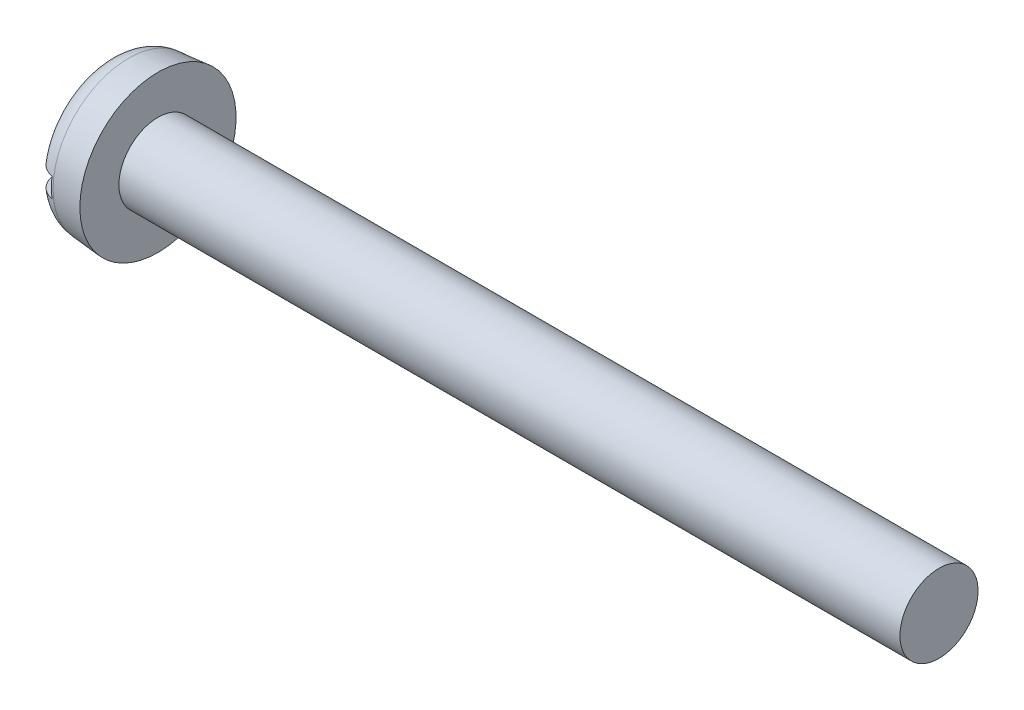
from build123d import *

# Parameters (mm, degrees)
FILLET2_R  = 0.6
SKETCH2_W  = 4
SKETCH2_H  = 0.5
SLOT_DEPTH = 0.5


with BuildPart() as part:
    # BodySke → Base-Revolve (revolve)
    with BuildSketch(Plane.XY, mode=Mode.PRIVATE) as base_revolve_sk:
        Polygon((1.3, 1), (1.3, 2), (0, 1.886264737), (0, 0), (21.3, 0), (21.3, 1), align=None)
    revolve(base_revolve_sk.sketch.rotate(Axis((-25.4, 0, 0), (1, 0, 0)), 90), axis=Axis((-25.4, 0, 0), (1, 0, 0)))

    # Fillet2
    fillet2_edges = [part.edges().sort_by_distance(p)[0] for p in [
        (0, 0, -1.886264737),
    ]]
    fillet(fillet2_edges, radius=FILLET2_R)

    # Sketch2 → Slot (cut)
    with BuildSketch(Plane(origin=(0, 0, 0), x_dir=(0, 0, -1), z_dir=(1, 0, 0))):
        Rectangle(SKETCH2_W, SKETCH2_H)
    extrude(amount=SLOT_DEPTH, mode=Mode.SUBTRACT)


solid = part.part
